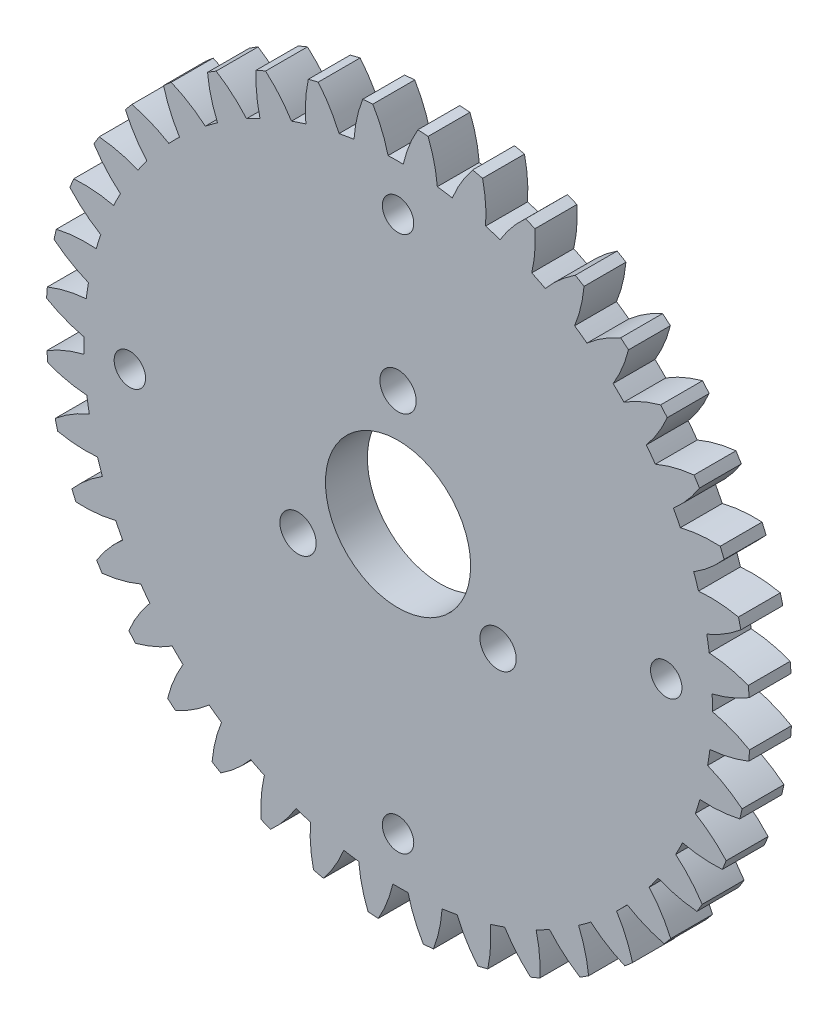
from build123d import *

# Parameters (mm, degrees)
SKETCH1_R           = 11
SKETCH1_R_2         = 2.75
SKETCH1_R_3         = 2.38125
BOSS_EXTRUDE1_DEPTH = 6.35


with BuildPart() as part:
    # Sketch1 → Boss-Extrude1 (new body)
    with BuildSketch(Plane.XY):
        with BuildLine():
            ThreePointArc((-53.25531002, 3.004588931), (-50.519604915, 1.682221979), (-47.617299719, 0.782576864))
            ThreePointArc((-47.617299719, 0.782576864), (-47.622325401, -0.365762868), (-47.599661726, -1.513889932))
            ThreePointArc((-47.599661726, -1.513889932), (-50.487805909, -2.458008545), (-53.202876617, -3.822240134))
            ThreePointArc((-53.202876617, -3.822240134), (-53.141860267, -4.59328721), (-53.069670044, -5.363368478))
            ThreePointArc((-53.069670044, -5.363368478), (-50.160782241, -6.241496333), (-47.153473737, -6.676044764))
            ThreePointArc((-47.153473737, -6.676044764), (-46.978797632, -7.811032718), (-46.776806341, -8.941479053))
            ThreePointArc((-46.776806341, -8.941479053), (-49.481699987, -10.325779289), (-51.94993083, -12.097945558))
            ThreePointArc((-51.94993083, -12.097945558), (-51.769047356, -12.849954704), (-51.577278663, -13.599261955))
            ThreePointArc((-51.577278663, -13.599261955), (-48.566834635, -14.011528292), (-45.528572737, -13.970280013))
            ThreePointArc((-45.528572737, -13.970280013), (-45.178495952, -15.06396902), (-44.802150741, -16.148899285))
            ThreePointArc((-44.802150741, -16.148899285), (-47.257190391, -17.939295078), (-49.417805334, -20.075759411))
            ThreePointArc((-49.417805334, -20.075759411), (-49.121508687, -20.790213667), (-48.814883506, -21.50029647))
            ThreePointArc((-48.814883506, -21.50029647), (-45.777010376, -21.436549923), (-42.782607176, -20.920520604))
            ThreePointArc((-42.782607176, -20.920520604), (-42.265749762, -21.945980409), (-41.7243175, -22.958680021))
            ThreePointArc((-41.7243175, -22.958680021), (-43.869051929, -25.111085885), (-45.668849463, -27.55924144))
            ThreePointArc((-45.668849463, -27.55924144), (-45.264435449, -28.218548571), (-44.85050391, -28.87192233))
            ThreePointArc((-44.85050391, -28.87192233), (-41.860004196, -28.333732551), (-38.983191839, -27.355628546))
            ThreePointArc((-38.983191839, -27.355628546), (-38.312280542, -28.287608927), (-37.619093087, -29.203141859))
            ThreePointArc((-37.619093087, -29.203141859), (-39.400711816, -31.664558419), (-40.795374951, -34.36412348))
            ThreePointArc((-40.795374951, -34.36412348), (-40.292801587, -34.952049157), (-39.781756057, -35.532625642))
            ThreePointArc((-39.781756057, -35.532625642), (-36.912265787, -34.533244649), (-34.223880941, -33.117150126))
            ThreePointArc((-34.223880941, -33.117150126), (-33.415435823, -33.932702631), (-32.587561751, -34.728525425))
            ThreePointArc((-32.587561751, -34.728525425), (-33.962195415, -37.438344436), (-34.917382916, -40.322846753))
            ThreePointArc((-34.917382916, -40.322846753), (-34.329025225, -40.824914293), (-33.733449343, -41.318397784))
            ThreePointArc((-33.733449343, -41.318397784), (-31.05562489, -39.882433654), (-28.621864512, -38.06321756))
            ThreePointArc((-28.621864512, -38.06321756), (-27.695792175, -38.742260581), (-26.753616493, -39.398777438))
            ThreePointArc((-26.753616493, -39.398777438), (-27.687417049, -42.290274162), (-28.17960903, -45.288687715))
            ThreePointArc((-28.17960903, -45.288687715), (-27.519954331, -45.69253455), (-26.85451315, -46.086773845))
            ThreePointArc((-26.85451315, -46.086773845), (-24.434291441, -44.249584781), (-22.315082788, -42.072042252))
            ThreePointArc((-22.315082788, -42.072042252), (-21.294186206, -42.597855497), (-20.260908408, -43.098900794))
            ThreePointArc((-20.260908408, -43.098900794), (-20.730882585, -46.100876985), (-20.747959646, -49.13937088))
            ThreePointArc((-20.747959646, -49.13937088), (-20.033250828, -49.435052961), (-19.314329719, -49.720340581))
            ThreePointArc((-19.314329719, -49.720340581), (-17.211304643, -47.527164275), (-15.458829666, -45.044913636))
            ThreePointArc((-15.458829666, -45.044913636), (-14.368246702, -45.404549836), (-13.269309515, -45.737786174))
            ThreePointArc((-13.269309515, -45.737786174), (-13.263884991, -48.776323216), (-12.805426638, -51.780079651))
            ThreePointArc((-12.805426638, -51.780079651), (-12.053262203, -51.960316303), (-11.298563389, -52.12962752))
            ThreePointArc((-11.298563389, -52.12962752), (-9.564518404, -49.63446725), (-8.221928853, -46.90862975))
            ThreePointArc((-8.221928853, -46.90862975), (-7.088513278, -47.09323347), (-5.950976183, -47.250455464))
            ThreePointArc((-5.950976183, -47.250455464), (-5.470286528, -50.25073449), (-4.547581527, -53.145791012))
            ThreePointArc((-4.547581527, -53.145791012), (-3.77648226, -53.20614421), (-3.004588931, -53.25531002))
            ThreePointArc((-3.004588931, -53.25531002), (-1.682221979, -50.519604915), (-0.782576864, -47.617299719))
            ThreePointArc((-0.782576864, -47.617299719), (0.365762868, -47.622325401), (1.513889932, -47.599661726))
            ThreePointArc((1.513889932, -47.599661726), (2.458008545, -50.487805909), (3.822240134, -53.202876617))
            ThreePointArc((3.822240134, -53.202876617), (4.59328721, -53.141860267), (5.363368478, -53.069670044))
            ThreePointArc((5.363368478, -53.069670044), (6.241496333, -50.160782241), (6.676044764, -47.153473737))
            ThreePointArc((6.676044764, -47.153473737), (7.811032718, -46.978797632), (8.941479053, -46.776806341))
            ThreePointArc((8.941479053, -46.776806341), (10.325779289, -49.481699987), (12.097945558, -51.94993083))
            ThreePointArc((12.097945558, -51.94993083), (12.849954704, -51.769047356), (13.599261955, -51.577278663))
            ThreePointArc((13.599261955, -51.577278663), (14.011528292, -48.566834635), (13.970280013, -45.528572737))
            ThreePointArc((13.970280013, -45.528572737), (15.06396902, -45.178495952), (16.148899285, -44.802150741))
            ThreePointArc((16.148899285, -44.802150741), (17.939295078, -47.257190391), (20.075759411, -49.417805334))
            ThreePointArc((20.075759411, -49.417805334), (20.790213667, -49.121508687), (21.50029647, -48.814883506))
            ThreePointArc((21.50029647, -48.814883506), (21.436549923, -45.777010376), (20.920520604, -42.782607176))
            ThreePointArc((20.920520604, -42.782607176), (21.945980409, -42.265749762), (22.958680021, -41.7243175))
            ThreePointArc((22.958680021, -41.7243175), (25.111085885, -43.869051929), (27.55924144, -45.668849463))
            ThreePointArc((27.55924144, -45.668849463), (28.218548571, -45.264435449), (28.87192233, -44.85050391))
            ThreePointArc((28.87192233, -44.85050391), (28.333732551, -41.860004196), (27.355628546, -38.983191839))
            ThreePointArc((27.355628546, -38.983191839), (28.287608927, -38.312280542), (29.203141859, -37.619093087))
            ThreePointArc((29.203141859, -37.619093087), (31.664558419, -39.400711816), (34.36412348, -40.795374951))
            ThreePointArc((34.36412348, -40.795374951), (34.952049157, -40.292801587), (35.532625642, -39.781756057))
            ThreePointArc((35.532625642, -39.781756057), (34.533244649, -36.912265787), (33.117150126, -34.223880941))
            ThreePointArc((33.117150126, -34.223880941), (33.932702631, -33.415435823), (34.728525425, -32.587561751))
            ThreePointArc((34.728525425, -32.587561751), (37.438344436, -33.962195415), (40.322846753, -34.917382916))
            ThreePointArc((40.322846753, -34.917382916), (40.824914293, -34.329025225), (41.318397784, -33.733449343))
            ThreePointArc((41.318397784, -33.733449343), (39.882433654, -31.05562489), (38.06321756, -28.621864512))
            ThreePointArc((38.06321756, -28.621864512), (38.742260581, -27.695792175), (39.398777438, -26.753616493))
            ThreePointArc((39.398777438, -26.753616493), (42.290274162, -27.687417049), (45.288687715, -28.17960903))
            ThreePointArc((45.288687715, -28.17960903), (45.69253455, -27.519954331), (46.086773845, -26.85451315))
            ThreePointArc((46.086773845, -26.85451315), (44.249584781, -24.434291441), (42.072042252, -22.315082788))
            ThreePointArc((42.072042252, -22.315082788), (42.597855497, -21.294186206), (43.098900794, -20.260908408))
            ThreePointArc((43.098900794, -20.260908408), (46.100876985, -20.730882585), (49.13937088, -20.747959646))
            ThreePointArc((49.13937088, -20.747959646), (49.435052961, -20.033250828), (49.720340581, -19.314329719))
            ThreePointArc((49.720340581, -19.314329719), (47.527164275, -17.211304643), (45.044913636, -15.458829666))
            ThreePointArc((45.044913636, -15.458829666), (45.404549836, -14.368246702), (45.737786174, -13.269309515))
            ThreePointArc((45.737786174, -13.269309515), (48.776323216, -13.263884991), (51.780079651, -12.805426638))
            ThreePointArc((51.780079651, -12.805426638), (51.960316303, -12.053262203), (52.12962752, -11.298563389))
            ThreePointArc((52.12962752, -11.298563389), (49.63446725, -9.564518404), (46.90862975, -8.221928853))
            ThreePointArc((46.90862975, -8.221928853), (47.09323347, -7.088513278), (47.250455464, -5.950976183))
            ThreePointArc((47.250455464, -5.950976183), (50.25073449, -5.470286528), (53.145791012, -4.547581527))
            ThreePointArc((53.145791012, -4.547581527), (53.20614421, -3.77648226), (53.25531002, -3.004588931))
            ThreePointArc((53.25531002, -3.004588931), (50.519604915, -1.682221979), (47.617299719, -0.782576864))
            ThreePointArc((47.617299719, -0.782576864), (47.622325401, 0.365762868), (47.599661726, 1.513889932))
            ThreePointArc((47.599661726, 1.513889932), (50.487805909, 2.458008545), (53.202876617, 3.822240134))
            ThreePointArc((53.202876617, 3.822240134), (53.141860267, 4.59328721), (53.069670044, 5.363368478))
            ThreePointArc((53.069670044, 5.363368478), (50.160782241, 6.241496333), (47.153473737, 6.676044764))
            ThreePointArc((47.153473737, 6.676044764), (46.978797632, 7.811032718), (46.776806341, 8.941479053))
            ThreePointArc((46.776806341, 8.941479053), (49.481699987, 10.325779289), (51.94993083, 12.097945558))
            ThreePointArc((51.94993083, 12.097945558), (51.769047356, 12.849954704), (51.577278663, 13.599261955))
            ThreePointArc((51.577278663, 13.599261955), (48.566834635, 14.011528292), (45.528572737, 13.970280013))
            ThreePointArc((45.528572737, 13.970280013), (45.178495952, 15.06396902), (44.802150741, 16.148899285))
            ThreePointArc((44.802150741, 16.148899285), (47.257190391, 17.939295078), (49.417805334, 20.075759411))
            ThreePointArc((49.417805334, 20.075759411), (49.121508687, 20.790213667), (48.814883506, 21.50029647))
            ThreePointArc((48.814883506, 21.50029647), (45.777010376, 21.436549923), (42.782607176, 20.920520604))
            ThreePointArc((42.782607176, 20.920520604), (42.265749762, 21.945980409), (41.7243175, 22.958680021))
            ThreePointArc((41.7243175, 22.958680021), (43.869051929, 25.111085885), (45.668849463, 27.55924144))
            ThreePointArc((45.668849463, 27.55924144), (45.264435449, 28.218548571), (44.85050391, 28.87192233))
            ThreePointArc((44.85050391, 28.87192233), (41.860004196, 28.333732551), (38.983191839, 27.355628546))
            ThreePointArc((38.983191839, 27.355628546), (38.312280542, 28.287608927), (37.619093087, 29.203141859))
            ThreePointArc((37.619093087, 29.203141859), (39.400711816, 31.664558419), (40.795374951, 34.36412348))
            ThreePointArc((40.795374951, 34.36412348), (40.292801587, 34.952049157), (39.781756057, 35.532625642))
            ThreePointArc((39.781756057, 35.532625642), (36.912265787, 34.533244649), (34.223880941, 33.117150126))
            ThreePointArc((34.223880941, 33.117150126), (33.415435823, 33.932702631), (32.587561751, 34.728525425))
            ThreePointArc((32.587561751, 34.728525425), (33.962195415, 37.438344436), (34.917382916, 40.322846753))
            ThreePointArc((34.917382916, 40.322846753), (34.329025225, 40.824914293), (33.733449343, 41.318397784))
            ThreePointArc((33.733449343, 41.318397784), (31.05562489, 39.882433654), (28.621864512, 38.06321756))
            ThreePointArc((28.621864512, 38.06321756), (27.695792175, 38.742260581), (26.753616493, 39.398777438))
            ThreePointArc((26.753616493, 39.398777438), (27.687417049, 42.290274162), (28.17960903, 45.288687715))
            ThreePointArc((28.17960903, 45.288687715), (27.519954331, 45.69253455), (26.85451315, 46.086773845))
            ThreePointArc((26.85451315, 46.086773845), (24.434291441, 44.249584781), (22.315082788, 42.072042252))
            ThreePointArc((22.315082788, 42.072042252), (21.294186206, 42.597855497), (20.260908408, 43.098900794))
            ThreePointArc((20.260908408, 43.098900794), (20.730882585, 46.100876985), (20.747959646, 49.13937088))
            ThreePointArc((20.747959646, 49.13937088), (20.033250828, 49.435052961), (19.314329719, 49.720340581))
            ThreePointArc((19.314329719, 49.720340581), (17.211304643, 47.527164275), (15.458829666, 45.044913636))
            ThreePointArc((15.458829666, 45.044913636), (14.368246702, 45.404549836), (13.269309515, 45.737786174))
            ThreePointArc((13.269309515, 45.737786174), (13.263884991, 48.776323216), (12.805426638, 51.780079651))
            ThreePointArc((12.805426638, 51.780079651), (12.053262203, 51.960316303), (11.298563389, 52.12962752))
            ThreePointArc((11.298563389, 52.12962752), (9.564518404, 49.63446725), (8.221928853, 46.90862975))
            ThreePointArc((8.221928853, 46.90862975), (7.088513278, 47.09323347), (5.950976183, 47.250455464))
            ThreePointArc((5.950976183, 47.250455464), (5.470286528, 50.25073449), (4.547581527, 53.145791012))
            ThreePointArc((4.547581527, 53.145791012), (3.77648226, 53.20614421), (3.004588931, 53.25531002))
            ThreePointArc((3.004588931, 53.25531002), (1.682221979, 50.519604915), (0.782576864, 47.617299719))
            ThreePointArc((0.782576864, 47.617299719), (-0.365762868, 47.622325401), (-1.513889932, 47.599661726))
            ThreePointArc((-1.513889932, 47.599661726), (-2.458008545, 50.487805909), (-3.822240134, 53.202876617))
            ThreePointArc((-3.822240134, 53.202876617), (-4.59328721, 53.141860267), (-5.363368478, 53.069670044))
            ThreePointArc((-5.363368478, 53.069670044), (-6.241496333, 50.160782241), (-6.676044764, 47.153473737))
            ThreePointArc((-6.676044764, 47.153473737), (-7.811032718, 46.978797632), (-8.941479053, 46.776806341))
            ThreePointArc((-8.941479053, 46.776806341), (-10.325779289, 49.481699987), (-12.097945558, 51.94993083))
            ThreePointArc((-12.097945558, 51.94993083), (-12.849954704, 51.769047356), (-13.599261955, 51.577278663))
            ThreePointArc((-13.599261955, 51.577278663), (-14.011528292, 48.566834635), (-13.970280013, 45.528572737))
            ThreePointArc((-13.970280013, 45.528572737), (-15.06396902, 45.178495952), (-16.148899285, 44.802150741))
            ThreePointArc((-16.148899285, 44.802150741), (-17.939295078, 47.257190391), (-20.075759411, 49.417805334))
            ThreePointArc((-20.075759411, 49.417805334), (-20.790213667, 49.121508687), (-21.50029647, 48.814883506))
            ThreePointArc((-21.50029647, 48.814883506), (-21.436549923, 45.777010376), (-20.920520604, 42.782607176))
            ThreePointArc((-20.920520604, 42.782607176), (-21.945980409, 42.265749762), (-22.958680021, 41.7243175))
            ThreePointArc((-22.958680021, 41.7243175), (-25.111085885, 43.869051929), (-27.55924144, 45.668849463))
            ThreePointArc((-27.55924144, 45.668849463), (-28.218548571, 45.264435449), (-28.87192233, 44.85050391))
            ThreePointArc((-28.87192233, 44.85050391), (-28.333732551, 41.860004196), (-27.355628546, 38.983191839))
            ThreePointArc((-27.355628546, 38.983191839), (-28.287608927, 38.312280542), (-29.203141859, 37.619093087))
            ThreePointArc((-29.203141859, 37.619093087), (-31.664558419, 39.400711816), (-34.36412348, 40.795374951))
            ThreePointArc((-34.36412348, 40.795374951), (-34.952049157, 40.292801587), (-35.532625642, 39.781756057))
            ThreePointArc((-35.532625642, 39.781756057), (-34.533244649, 36.912265787), (-33.117150126, 34.223880941))
            ThreePointArc((-33.117150126, 34.223880941), (-33.932702631, 33.415435823), (-34.728525425, 32.587561751))
            ThreePointArc((-34.728525425, 32.587561751), (-37.438344436, 33.962195415), (-40.322846753, 34.917382916))
            ThreePointArc((-40.322846753, 34.917382916), (-40.824914293, 34.329025225), (-41.318397784, 33.733449343))
            ThreePointArc((-41.318397784, 33.733449343), (-39.882433654, 31.05562489), (-38.06321756, 28.621864512))
            ThreePointArc((-38.06321756, 28.621864512), (-38.742260581, 27.695792175), (-39.398777438, 26.753616493))
            ThreePointArc((-39.398777438, 26.753616493), (-42.290274162, 27.687417049), (-45.288687715, 28.17960903))
            ThreePointArc((-45.288687715, 28.17960903), (-45.69253455, 27.519954331), (-46.086773845, 26.85451315))
            ThreePointArc((-46.086773845, 26.85451315), (-44.249584781, 24.434291441), (-42.072042252, 22.315082788))
            ThreePointArc((-42.072042252, 22.315082788), (-42.597855497, 21.294186206), (-43.098900794, 20.260908408))
            ThreePointArc((-43.098900794, 20.260908408), (-46.100876985, 20.730882585), (-49.13937088, 20.747959646))
            ThreePointArc((-49.13937088, 20.747959646), (-49.435052961, 20.033250828), (-49.720340581, 19.314329719))
            ThreePointArc((-49.720340581, 19.314329719), (-47.527164275, 17.211304643), (-45.044913636, 15.458829666))
            ThreePointArc((-45.044913636, 15.458829666), (-45.404549836, 14.368246702), (-45.737786174, 13.269309515))
            ThreePointArc((-45.737786174, 13.269309515), (-48.776323216, 13.263884991), (-51.780079651, 12.805426638))
            ThreePointArc((-51.780079651, 12.805426638), (-51.960316303, 12.053262203), (-52.12962752, 11.298563389))
            ThreePointArc((-52.12962752, 11.298563389), (-49.63446725, 9.564518404), (-46.90862975, 8.221928853))
            ThreePointArc((-46.90862975, 8.221928853), (-47.09323347, 7.088513278), (-47.250455464, 5.950976183))
            ThreePointArc((-47.250455464, 5.950976183), (-50.25073449, 5.470286528), (-53.145791012, 4.547581527))
            ThreePointArc((-53.145791012, 4.547581527), (-53.20614421, 3.77648226), (-53.25531002, 3.004588931))
        make_face()
        Circle(SKETCH1_R, mode=Mode.SUBTRACT)
        with Locations((0, 17.5)):
            Circle(SKETCH1_R_2, mode=Mode.SUBTRACT)
        with Locations((15.155444566, -8.75)):
            Circle(SKETCH1_R_2, mode=Mode.SUBTRACT)
        with Locations((-15.155444566, -8.75)):
            Circle(SKETCH1_R_2, mode=Mode.SUBTRACT)
        with Locations((0, 40.64)):
            Circle(SKETCH1_R_3, mode=Mode.SUBTRACT)
        with Locations((40.64, 0)):
            Circle(SKETCH1_R_3, mode=Mode.SUBTRACT)
        with Locations((0, -40.64)):
            Circle(SKETCH1_R_3, mode=Mode.SUBTRACT)
        with Locations((-40.64, 0)):
            Circle(SKETCH1_R_3, mode=Mode.SUBTRACT)
    extrude(amount=BOSS_EXTRUDE1_DEPTH)


solid = part.part
